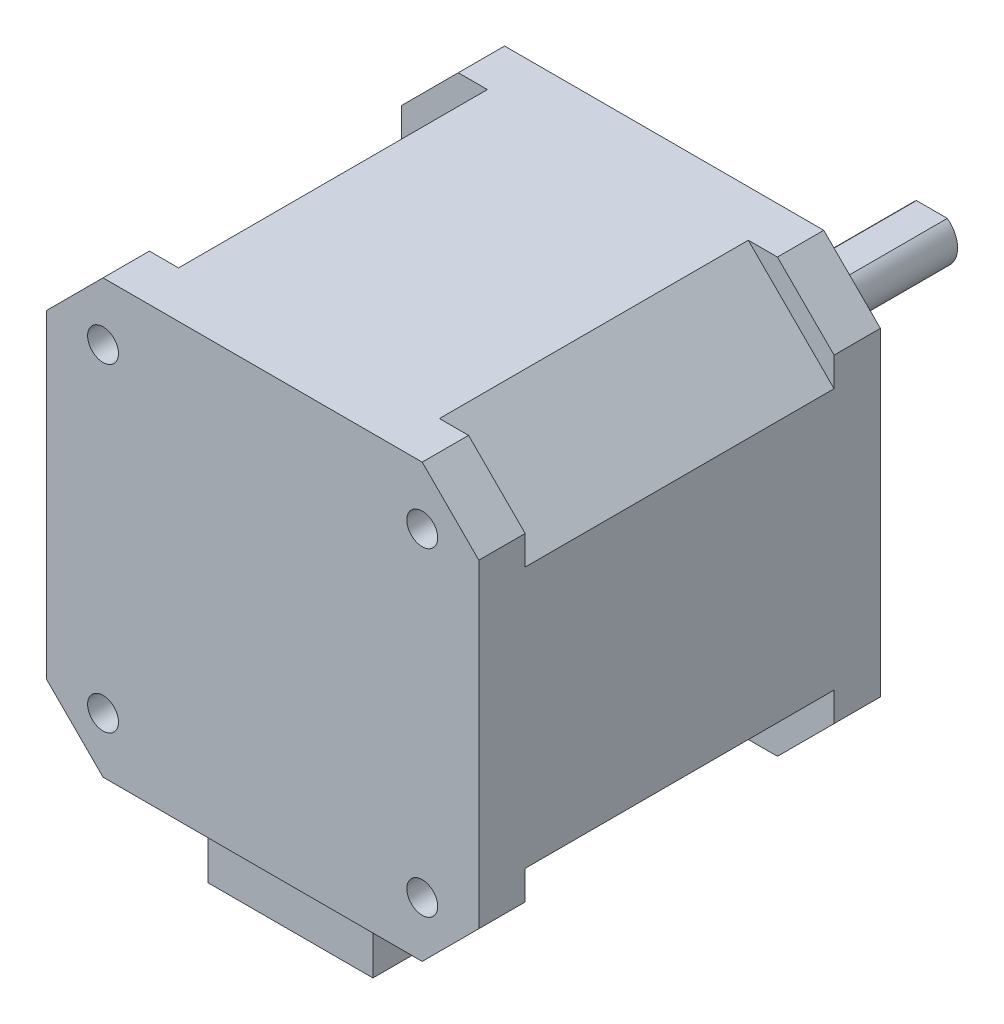
from build123d import *

# Parameters (mm, degrees)
SKETCH1_R           = 1.5
BOSS_EXTRUDE1_DEPTH = 4.5
BOSS_EXTRUDE2_DEPTH = 30
SKETCH3_R           = 1.5
BOSS_EXTRUDE3_DEPTH = 4.5
SKETCH5_R           = 11
BOSS_EXTRUDE4_DEPTH = 2
SKETCH6_R           = 2.5
BOSS_EXTRUDE5_DEPTH = 24
SKETCH7_W           = 14
SKETCH7_H           = 0.5
CUT_EXTRUDE2_DEPTH  = 72.056315694
SKETCH8_W           = 8
SKETCH8_H           = 8.285823085
BOSS_EXTRUDE6_DEPTH = 6.5


with BuildPart() as part:
    # Sketch1 → Boss-Extrude1 (new body)
    with BuildSketch(Plane.XY):
        Polygon((0, 36.5), (5.5, 42), (36.5, 42), (42, 36.5), (42, 5.5), (36.5, 0), (5.5, 0), (0, 5.5), align=None)
        with Locations((5.5, 36.382666597)):
            Circle(SKETCH1_R, mode=Mode.SUBTRACT)
        with Locations((36.5, 36.382666597)):
            Circle(SKETCH1_R, mode=Mode.SUBTRACT)
        with Locations((36.5, 5.382666597)):
            Circle(SKETCH1_R, mode=Mode.SUBTRACT)
        with Locations((5.5, 5.382666597)):
            Circle(SKETCH1_R, mode=Mode.SUBTRACT)
    extrude(amount=BOSS_EXTRUDE1_DEPTH)

    # Sketch2 → Boss-Extrude2 (add)
    with BuildSketch(Plane.XY.offset(4.5)):
        Polygon((8.328427125, 42), (0, 33.671572875), (0, 8.328427125), (8.328427125, 0), (33.671572875, 0), (42, 8.328427125), (42, 33.671572875), (33.671572875, 42), align=None)
    extrude(amount=BOSS_EXTRUDE2_DEPTH)

    # Sketch3 → Boss-Extrude3 (add)
    with BuildSketch(Plane.XY.offset(34.5)):
        Polygon((36.5, 42), (5.5, 42), (0, 36.5), (0, 5.5), (5.5, 0), (36.5, 0), (42, 5.5), (42, 36.5), align=None)
        with Locations((5.5, 5.382666597)):
            Circle(SKETCH3_R, mode=Mode.SUBTRACT)
        with Locations((36.5, 5.382666597)):
            Circle(SKETCH3_R, mode=Mode.SUBTRACT)
        with Locations((5.5, 36.382666597)):
            Circle(SKETCH3_R, mode=Mode.SUBTRACT)
        with Locations((36.5, 36.382666597)):
            Circle(SKETCH3_R, mode=Mode.SUBTRACT)
    extrude(amount=BOSS_EXTRUDE3_DEPTH)

    # Sketch5 → Boss-Extrude4 (add)
    with BuildSketch(Plane(origin=(0, 0, 0), x_dir=(-1, 0, 0), z_dir=(0, 0, -1))):
        with Locations((-21, 21)):
            Circle(SKETCH5_R)
    extrude(amount=BOSS_EXTRUDE4_DEPTH)

    # Sketch6 → Boss-Extrude5 (add)
    with BuildSketch(Plane(origin=(0, 0, -2), x_dir=(-1, 0, 0), z_dir=(0, 0, -1))):
        with Locations((-21, 21)):
            Circle(SKETCH6_R)
    extrude(amount=BOSS_EXTRUDE5_DEPTH)

    # Sketch7 → Cut-Extrude2 (cut, through all)
    with BuildSketch(Plane.ZY):
        with Locations((-19, 23.25)):
            Rectangle(SKETCH7_W, SKETCH7_H)
    extrude(amount=-CUT_EXTRUDE2_DEPTH, mode=Mode.SUBTRACT)

    # Sketch8 → Boss-Extrude6 (add)
    with BuildSketch(Plane.XZ):
        with Locations((17, 32.142911543)):
            Rectangle(SKETCH8_W, SKETCH8_H)
        with Locations((25, 32.142911543)):
            Rectangle(SKETCH8_W, SKETCH8_H)
    extrude(amount=BOSS_EXTRUDE6_DEPTH)


solid = part.part
